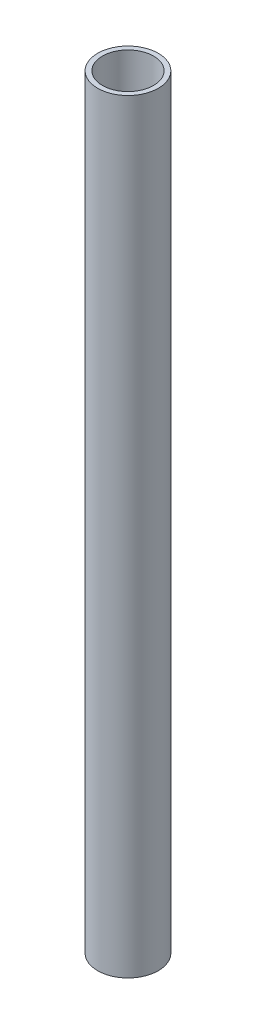
from build123d import *

# Parameters (mm, degrees)
SKETCH1_R           = 12.7
SKETCH1_R_2         = 10.7
BOSS_EXTRUDE1_DEPTH = 320


with BuildPart() as part:
    # Sketch1 → Boss-Extrude1 (new body)
    with BuildSketch(Plane(origin=(0, 0, 0), x_dir=(1, 0, 0), z_dir=(0, 1, 0))):
        with Locations(Location((0, 0, 0), (0, 0, 270))):
            Circle(SKETCH1_R)
        with Locations(Location((0, 0, 0), (0, 0, 270))):
            Circle(SKETCH1_R_2, mode=Mode.SUBTRACT)
    extrude(amount=BOSS_EXTRUDE1_DEPTH)


solid = part.part
